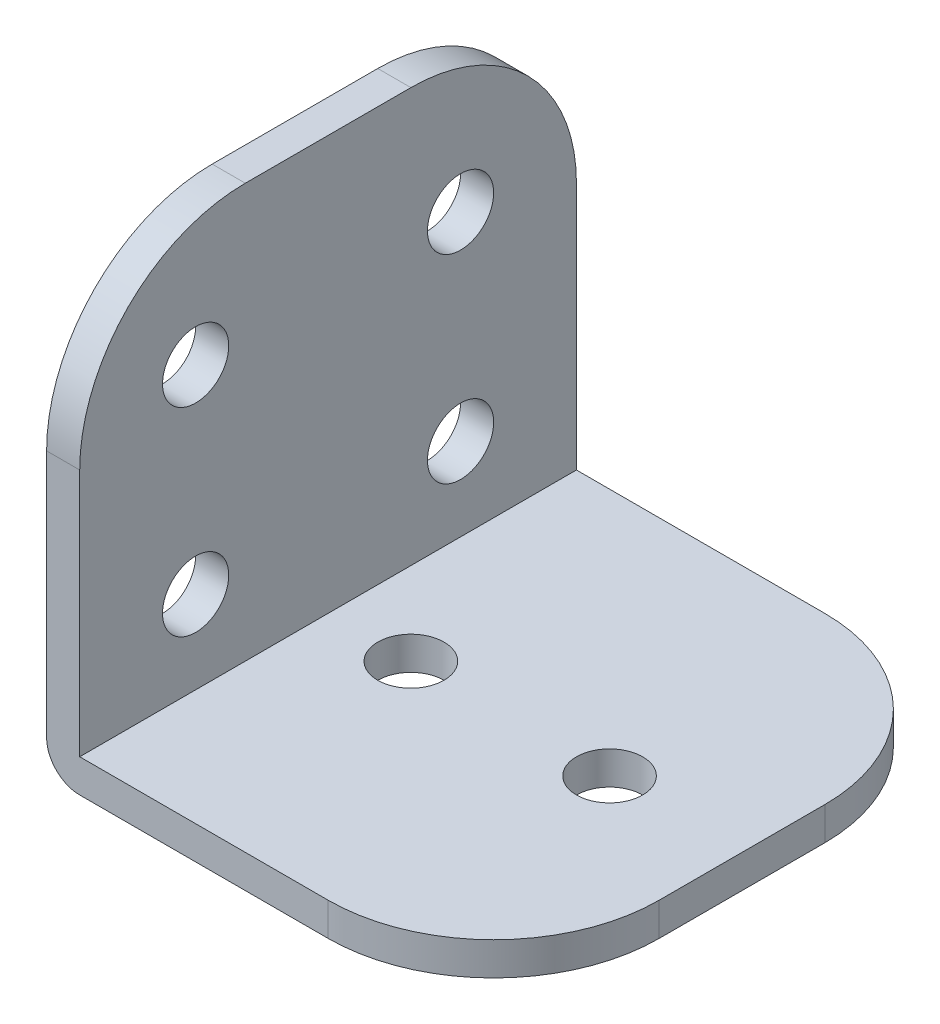
from build123d import *

# Parameters (mm, degrees)
BOSS_EXTRU_1_DEPTH = 15
CONG_1_R           = 10
SKETCH4_R          = 2
CUT_EXTRUDE3_DEPTH = 10
SKETCH5_R          = 2
CUT_EXTRUDE4_DEPTH = 10


with BuildPart() as part:
    # Esquisse1 → Boss.-Extru.1 (new, symmetric)
    with BuildSketch(Plane.XY):
        with BuildLine():
            Line((0, 2), (0, 27))
            Line((0, 27), (2, 27))
            Line((2, 27), (2, 2))
            Line((2, 2), (27, 2))
            Line((27, 2), (27, 0))
            Line((27, 0), (2, 0))
            ThreePointArc((2, 0), (0.585786438, 0.585786438), (0, 2))
        make_face()
    extrude(amount=BOSS_EXTRU_1_DEPTH, both=True)

    # Congé1
    cong_1_edges = [part.edges().sort_by_distance(p)[0] for p in [
        (27, 1, 15),
        (1, 27, 15),
        (27, 1, -15),
        (1, 27, -15),
    ]]
    fillet(cong_1_edges, radius=CONG_1_R)

    # Sketch4 → Cut-Extrude3 (cut)
    with BuildSketch(Plane(origin=(0, 2, 0), x_dir=(1, 0, 0), z_dir=(0, 1, 0))):
        with Locations(Location((7, 0, 0), (0, 0, 270))):
            Circle(SKETCH4_R)
        with Locations(Location((19, 0, 0), (0, 0, 270))):
            Circle(SKETCH4_R)
    extrude(amount=-CUT_EXTRUDE3_DEPTH, mode=Mode.SUBTRACT)

    # Sketch5 → Cut-Extrude4 (cut)
    with BuildSketch(Plane(origin=(2, 0, 0), x_dir=(0, 0, -1), z_dir=(1, 0, 0))):
        with Locations((-8, 19)):
            Circle(SKETCH5_R)
        with Locations((8, 19)):
            Circle(SKETCH5_R)
        with Locations((8, 7)):
            Circle(SKETCH5_R)
        with Locations((-8, 7)):
            Circle(SKETCH5_R)
    extrude(amount=-CUT_EXTRUDE4_DEPTH, mode=Mode.SUBTRACT)


solid = part.part
